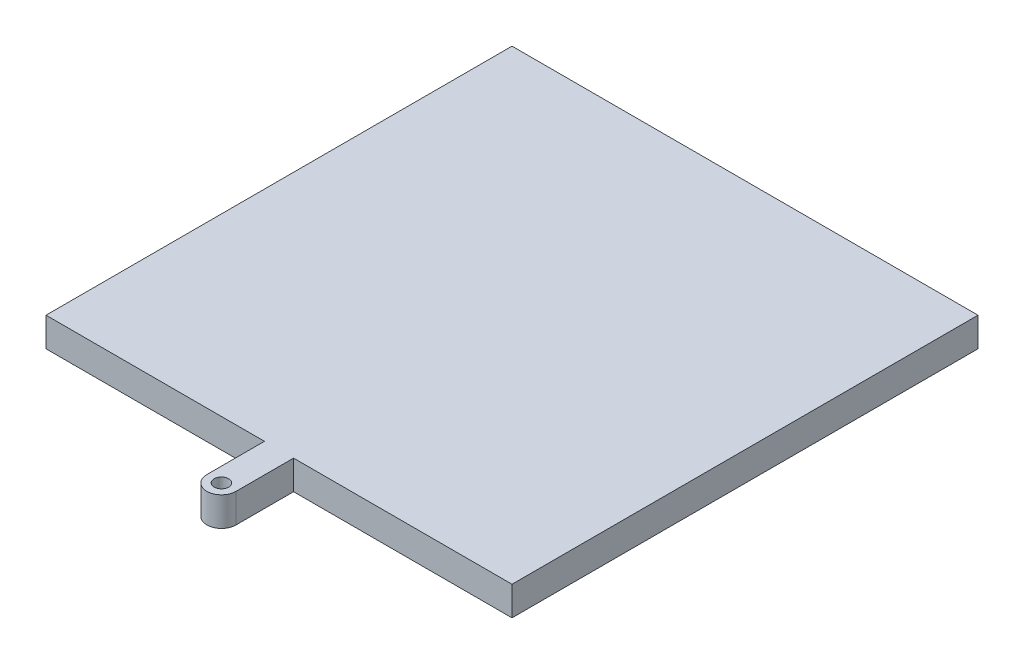
from build123d import *

# Parameters (mm, degrees)
SKETCH2_W           = 80
SKETCH2_H           = 80
BOSS_EXTRUDE1_DEPTH = 5
SKETCH3_R           = 1.25
BOSS_EXTRUDE2_DEPTH = 5


with BuildPart() as part:
    # Sketch2 → Boss-Extrude1 (new body)
    with BuildSketch(Plane(origin=(0, 0, 0), x_dir=(1, 0, 0), z_dir=(0, 1, 0))):
        with Locations((40, -40)):
            Rectangle(SKETCH2_W, SKETCH2_H)
    extrude(amount=BOSS_EXTRUDE1_DEPTH)

    # Sketch3 → Boss-Extrude2 (add)
    with BuildSketch(Plane(origin=(0, 5, 0), x_dir=(1, 0, 0), z_dir=(0, 1, 0))):
        with BuildLine():
            Line((37.5, -80), (37.5, -89.881652202))
            ThreePointArc((37.5, -89.881652202), (40, -92.381652202), (42.5, -89.881652202))
            Line((42.5, -89.881652202), (42.5, -80))
            Line((42.5, -80), (37.5, -80))
        make_face()
        with Locations((40, -89.881652202)):
            Circle(SKETCH3_R, mode=Mode.SUBTRACT)
    extrude(amount=-BOSS_EXTRUDE2_DEPTH)


solid = part.part
